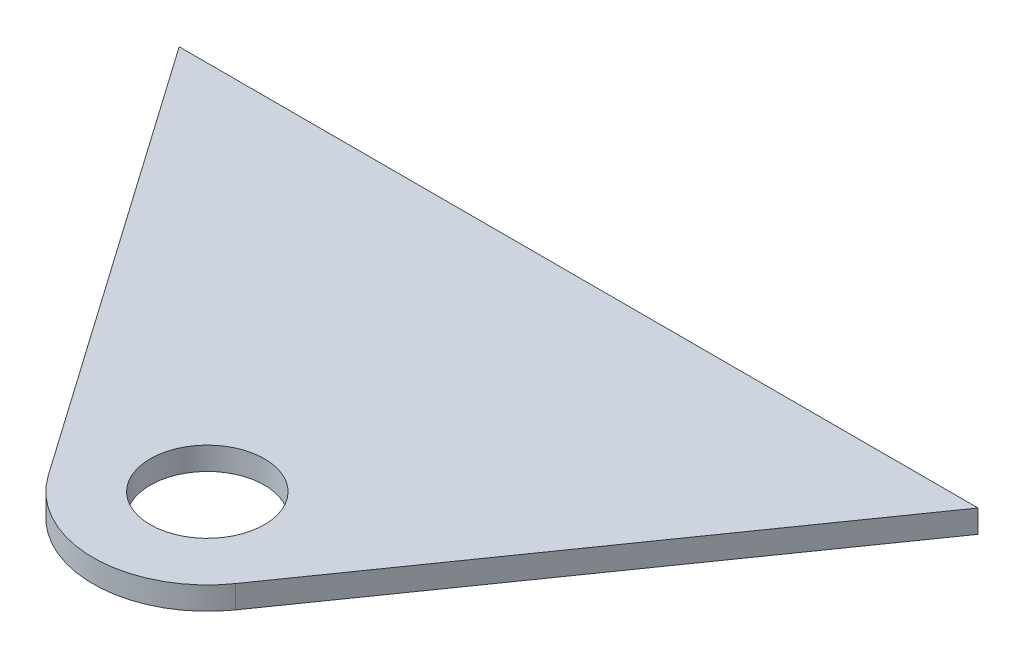
from build123d import *

# Parameters (mm, degrees)
SKETCH1_R           = 6.35
BOSS_EXTRUDE1_DEPTH = 2.54


with BuildPart() as part:
    # Sketch1 → Boss-Extrude1 (new body)
    with BuildSketch(Plane(origin=(0, 0, 0), x_dir=(1, 0, 0), z_dir=(0, 1, 0))):
        with BuildLine():
            Line((10.403230962, -7.284420742), (44.404903417, 41.275))
            Line((44.404903417, 41.275), (-44.404903417, 41.275))
            Line((-44.404903417, 41.275), (-10.403230962, -7.284420742))
            ThreePointArc((-10.403230962, -7.284420742), (0, -12.7), (10.403230962, -7.284420742))
        make_face()
        with Locations(Location((0, 0, 0), (0, 0, 270))):
            Circle(SKETCH1_R, mode=Mode.SUBTRACT)
    extrude(amount=BOSS_EXTRUDE1_DEPTH)


solid = part.part
